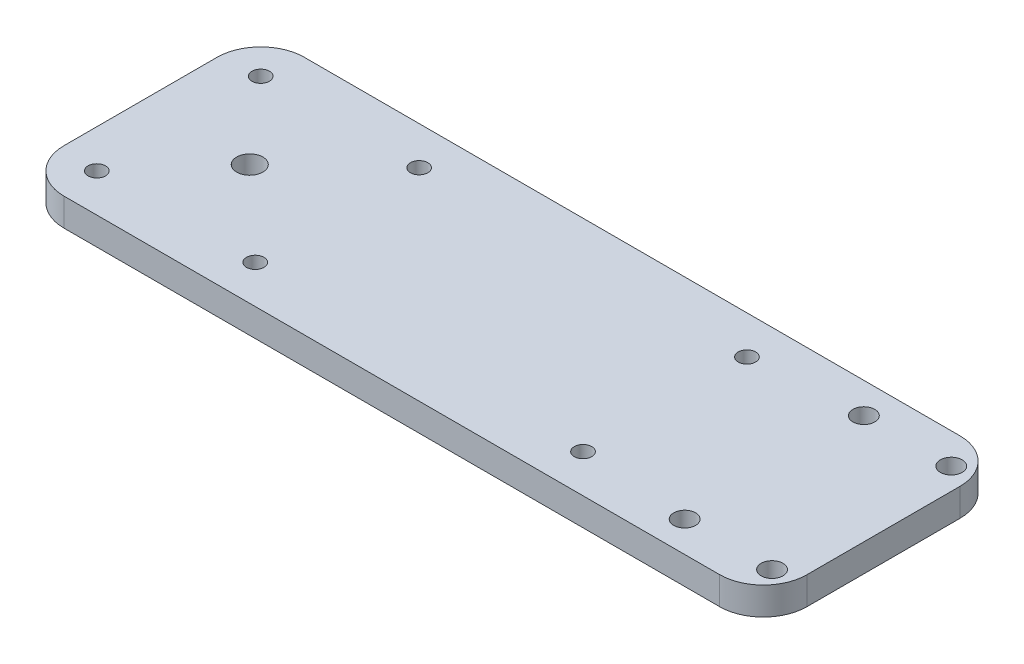
from build123d import *

# Parameters (mm, degrees)
SKETCH1_W                 = 170
SKETCH1_H                 = 55
BOSS_EXTRUDE1_DEPTH       = 6.35
FILLET1_R                 = 10
F_6_0MM_DOWEL_HOLE1_D     = 6
F_4_0MM_DOWEL_HOLE1_D     = 4
F_4_0MM_DOWEL_HOLE1_DEPTH = 6.35
F_5_0MM_DOWEL_HOLE1_D     = 5


with BuildPart() as part:
    # Sketch1 → Boss-Extrude1 (new body)
    with BuildSketch(Plane(origin=(0, 0, 0), x_dir=(1, 0, 0), z_dir=(0, 1, 0))):
        with Locations((60, 0)):
            Rectangle(SKETCH1_W, SKETCH1_H)
    extrude(amount=BOSS_EXTRUDE1_DEPTH)

    # Fillet1
    fillet1_edges = [part.edges().sort_by_distance(p)[0] for p in [
        (-25, 3.175, -27.5),
        (145, 3.175, -27.5),
        (145, 3.175, 27.5),
        (-25, 3.175, 27.5),
    ]]
    fillet(fillet1_edges, radius=FILLET1_R)

    # Ø6.0mm Dowel Hole1 (through all)
    with Locations(Plane(origin=(0, 6.35, 0), x_dir=(1, 0, 0), z_dir=(0, 1, 0))):
        with Locations((0, 0)):
            Hole(F_6_0MM_DOWEL_HOLE1_D / 2)

    # Ø4.0mm Dowel Hole1
    with Locations(Plane(origin=(0, 6.35, 0), x_dir=(1, 0, 0), z_dir=(0, 1, 0))):
        with Locations((-16.25, -18.75), (20, -18.75), (95, -18.75), (170, -18.75), (170, 18.75), (95, 18.75), (20, 18.75), (-16.25, 18.75)):
            Hole(F_4_0MM_DOWEL_HOLE1_D / 2, depth=F_4_0MM_DOWEL_HOLE1_DEPTH)

    # Ø5.0mm Dowel Hole1 (through all)
    with Locations(Plane(origin=(0, 6.35, 0), x_dir=(1, 0, 0), z_dir=(0, 1, 0))):
        with Locations((140, 20.5), (120, 20.5), (140, -20.5), (120, -20.5)):
            Hole(F_5_0MM_DOWEL_HOLE1_D / 2)


solid = part.part
